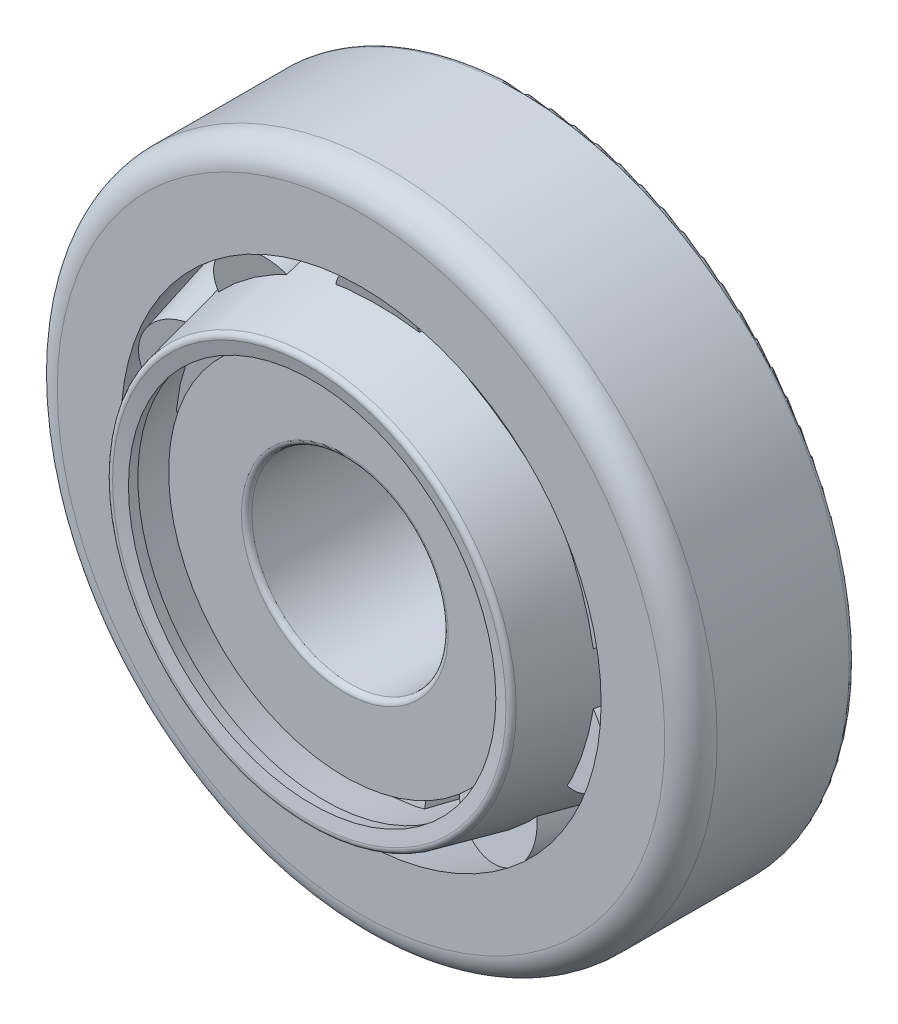
from build123d import *

# Parameters (mm, degrees)
CIRPATTERN1_COUNT = 10
FILLET1_R         = 1.27
FILLET2_R         = 1.27
FILLET3_R         = 0.254
FILLET4_R         = 0.254
FILLET5_R         = 0.254


with BuildPart() as part:
    # Sketch2 → Revolve1 (revolve)
    with BuildSketch(Plane(origin=(0, 0, 0), x_dir=(0, 0, -1), z_dir=(1, 0, 0))):
        Polygon((-3.96875, 16.002), (-3.96875, 11.645), (3.96875, 13.79), (3.96875, 16.002), align=None)
    revolve(axis=Axis((0, 0, 0), (0, 0, -1)))

    # Fillet2
    fillet2_edges = [part.edges().sort_by_distance(p)[0] for p in [
        (0, -16.002, 3.96875),
    ]]
    fillet(fillet2_edges, radius=FILLET2_R)

    # Fillet4
    fillet4_edges = [part.edges().sort_by_distance(p)[0] for p in [
        (0, -16.002, -3.96875),
    ]]
    fillet(fillet4_edges, radius=FILLET4_R)


with BuildPart() as body_2:
    # Sketch3 → Revolve2 (revolve)
    with BuildSketch(Plane(origin=(0, 0, 0), x_dir=(0, 0, -1), z_dir=(1, 0, 0))):
        Polygon((-4.75615, 8.545), (-4.75615, 4.7625), (6.03885, 4.7625), (6.03885, 9.975), (4.284796409, 9.975), (4.538578666, 8.822152943), (-2.556391562, 7.608440676), (-2.762561268, 8.545), align=None)
    revolve(axis=Axis((0, 0, 0), (0, 0, -1)))

    # Fillet1
    fillet1_edges = [body_2.edges().sort_by_distance(p)[0] for p in [
        (0, -4.7625, -6.03885),
    ]]
    fillet(fillet1_edges, radius=FILLET1_R)

    # Fillet3
    fillet3_edges = [body_2.edges().sort_by_distance(p)[0] for p in [
        (0, -4.7625, 4.75615),
    ]]
    fillet(fillet3_edges, radius=FILLET3_R)


with BuildPart() as body_3:
    # Sketch4 → Revolve3 (revolve)
    with BuildSketch(Plane(origin=(0, 0, 0), x_dir=(0, 0, -1), z_dir=(1, 0, 0))):
        Polygon((5.27685, 11.774917497), (5.147857347, 12.360887543), (-6.53415, 9.789266125), (-6.34066102, 8.910311055), (-5.754690974, 9.039303709), (-5.8191873, 9.332288732), align=None)
    revolve(axis=Axis((0, 0, 0), (0, 0, -1)))

    # Fillet5
    fillet5_edges = [body_3.edges().sort_by_distance(p)[0] for p in [
        (0, -9.789266125, 6.53415),
    ]]
    fillet(fillet5_edges, radius=FILLET5_R)


with BuildPart() as body_4:
    # Sketch6 → Revolve4 (revolve)
    with BuildSketch(Plane(origin=(0, 0, 0), x_dir=(0, 0, -1), z_dir=(1, 0, 0))):
        Polygon((4.538578666, 8.822152943), (4.006483971, 11.239279385), (-3.01539042, 9.693517424), (-2.556391562, 7.608440676), align=None)
    revolve(axis=Axis((0, 9.693517424, 3.01539042), (0, 0.21498775526235864, -0.9766167442181464)))


with BuildPart() as cirpattern1_1:
    # CirPattern1: pattern copy
    add(body_4.part.rotate(Axis((0, 0, 0), (0, 0, -1)), 1 * 360 / CIRPATTERN1_COUNT))


with BuildPart() as cirpattern1_2:
    # CirPattern1: pattern copy
    add(body_4.part.rotate(Axis((0, 0, 0), (0, 0, -1)), 2 * 360 / CIRPATTERN1_COUNT))


with BuildPart() as cirpattern1_3:
    # CirPattern1: pattern copy
    add(body_4.part.rotate(Axis((0, 0, 0), (0, 0, -1)), 3 * 360 / CIRPATTERN1_COUNT))


with BuildPart() as cirpattern1_4:
    # CirPattern1: pattern copy
    add(body_4.part.rotate(Axis((0, 0, 0), (0, 0, -1)), 4 * 360 / CIRPATTERN1_COUNT))


with BuildPart() as cirpattern1_5:
    # CirPattern1: pattern copy
    add(body_4.part.rotate(Axis((0, 0, 0), (0, 0, -1)), 5 * 360 / CIRPATTERN1_COUNT))


with BuildPart() as cirpattern1_6:
    # CirPattern1: pattern copy
    add(body_4.part.rotate(Axis((0, 0, 0), (0, 0, -1)), 6 * 360 / CIRPATTERN1_COUNT))


with BuildPart() as cirpattern1_7:
    # CirPattern1: pattern copy
    add(body_4.part.rotate(Axis((0, 0, 0), (0, 0, -1)), 7 * 360 / CIRPATTERN1_COUNT))


with BuildPart() as cirpattern1_8:
    # CirPattern1: pattern copy
    add(body_4.part.rotate(Axis((0, 0, 0), (0, 0, -1)), 8 * 360 / CIRPATTERN1_COUNT))


with BuildPart() as cirpattern1_9:
    # CirPattern1: pattern copy
    add(body_4.part.rotate(Axis((0, 0, 0), (0, 0, -1)), 9 * 360 / CIRPATTERN1_COUNT))


solid = Compound([part.part, body_2.part, body_3.part, body_4.part, cirpattern1_1.part, cirpattern1_2.part, cirpattern1_3.part, cirpattern1_4.part, cirpattern1_5.part, cirpattern1_6.part, cirpattern1_7.part, cirpattern1_8.part, cirpattern1_9.part])
